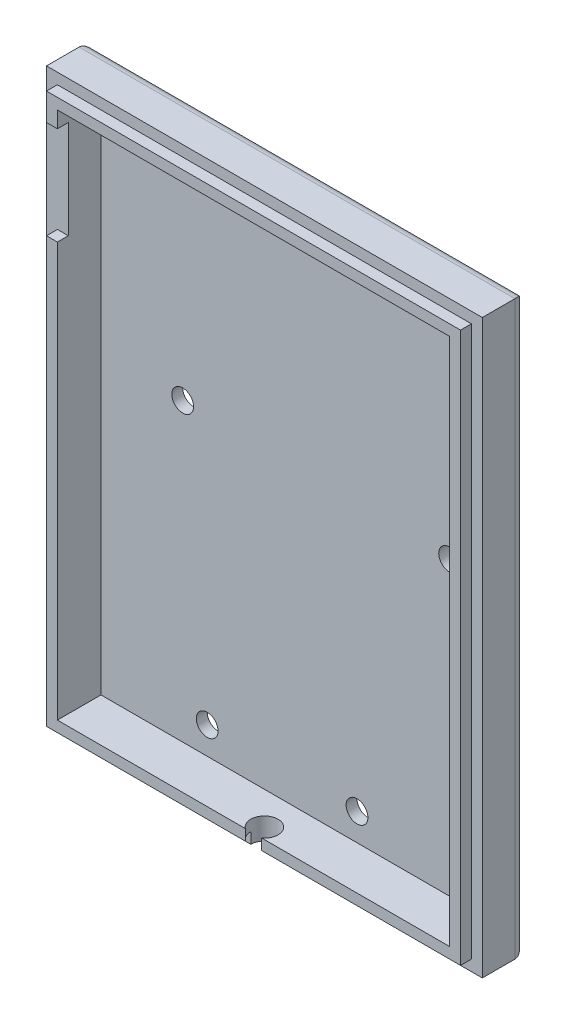
from build123d import *

# Parameters (mm, degrees)
SKETCH1_W           = 80
SKETCH1_H           = 105
SKETCH1_W_2         = 60
SKETCH1_H_2         = 71.314940153
SKETCH1_R           = 2
BOSS_EXTRUDE2_DEPTH = 8
SKETCH2_W           = 72
SKETCH2_H           = 97
CUT_EXTRUDE1_DEPTH  = 6
SKETCH3_W           = 76
SKETCH3_H           = 101
BOSS_EXTRUDE3_DEPTH = 2
SKETCH4_W           = 72
SKETCH4_H           = 97
CUT_EXTRUDE2_DEPTH  = 2
SKETCH5_R           = 2.5
CUT_EXTRUDE3_DEPTH  = 5
FILLET1_R           = 2
SKETCH6_W           = 2
SKETCH6_H           = 18
CUT_EXTRUDE4_DEPTH  = 2


with BuildPart() as part:
    # Sketch1 → Boss-Extrude2 (new body)
    # profile 1 of 2: a face of its own
    with BuildSketch(Plane.XY):
        with Locations((35, -13.965517241)):
            Rectangle(SKETCH1_W, SKETCH1_H)
        with Locations((37, -26.808047164)):
            Rectangle(SKETCH1_W_2, SKETCH1_H_2, mode=Mode.SUBTRACT)
    # profile 2 of 2: a face of its own
    with BuildSketch(Plane.XY):
        with Locations((37, -26.808047164)):
            Rectangle(SKETCH1_W_2, SKETCH1_H_2)
        with Locations((14, -8.150577088)):
            Circle(SKETCH1_R, mode=Mode.SUBTRACT)
        with Locations((18.5, -57.465517241)):
            Circle(SKETCH1_R, mode=Mode.SUBTRACT)
        with Locations((46, -57.465517241)):
            Circle(SKETCH1_R, mode=Mode.SUBTRACT)
        with Locations((63, -8.950577088)):
            Circle(SKETCH1_R, mode=Mode.SUBTRACT)
    extrude(amount=BOSS_EXTRUDE2_DEPTH)

    # Sketch2 → Cut-Extrude1 (cut)
    with BuildSketch(Plane.XY.offset(8)):
        with Locations((35, -13.965517241)):
            Rectangle(SKETCH2_W, SKETCH2_H)
    extrude(amount=-CUT_EXTRUDE1_DEPTH, mode=Mode.SUBTRACT)

    # Sketch3 → Boss-Extrude3 (add)
    with BuildSketch(Plane.XY.offset(8)):
        with Locations((35, -13.965517241)):
            Rectangle(SKETCH3_W, SKETCH3_H)
    extrude(amount=BOSS_EXTRUDE3_DEPTH)

    # Sketch4 → Cut-Extrude2 (cut)
    with BuildSketch(Plane.XY.offset(10)):
        with Locations((35, -13.965517241)):
            Rectangle(SKETCH4_W, SKETCH4_H)
    extrude(amount=-CUT_EXTRUDE2_DEPTH, mode=Mode.SUBTRACT)

    # Sketch5 → Cut-Extrude3 (cut)
    with BuildSketch(Plane(origin=(0, -66.465517241, 0), x_dir=(-1, 0, 0), z_dir=(0, -1, 0))):
        with Locations((-35, -8)):
            Circle(SKETCH5_R)
    extrude(amount=-CUT_EXTRUDE3_DEPTH, mode=Mode.SUBTRACT)

    # Fillet1
    fillet1_edges = [part.edges().sort_by_distance(p)[0] for p in [
        (35, -66.465517241, 0),
        (-5, -13.965517241, 0),
        (35, 38.534482759, 0),
        (75, -13.965517241, 0),
    ]]
    fillet(fillet1_edges, radius=FILLET1_R)

    # Sketch6 → Cut-Extrude4 (cut)
    with BuildSketch(Plane.XY.offset(10)):
        with Locations((-2, 22.534482759)):
            Rectangle(SKETCH6_W, SKETCH6_H)
    extrude(amount=-CUT_EXTRUDE4_DEPTH, mode=Mode.SUBTRACT)


solid = part.part
